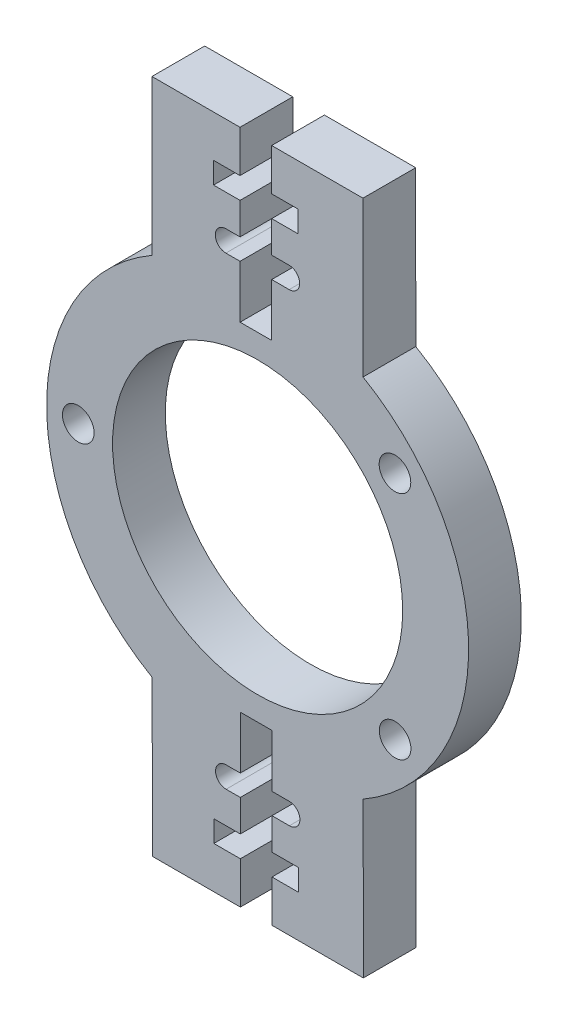
from build123d import *
from build123d.topology import SkipClean

# Parameters (mm, degrees)
SKETCH1_R           = 1.5
BOSS_EXTRUDE1_DEPTH = 5


with BuildPart() as part:
    # Sketch1 → Boss-Extrude1 (new body)
    with BuildSketch(Plane(origin=(0, 0, 0), x_dir=(-0.9999998655639977, -0.000518528674721734, 0), z_dir=(0, 0, 1))):
        with BuildLine():
            Line((20, 0), (18.5, 0))
            ThreePointArc((18.5, 0), (17, -1.5), (15.5, 0))
            Line((15.5, 0), (13.75, 0))
            ThreePointArc((13.75, 0), (0, -13.75), (-13.75, 0))
            Line((-13.75, 0), (-20, 0))
            ThreePointArc((-20, 0), (-17.320508076, -10), (-10, -17.320508076))
            Line((-10, -17.320508076), (-10, -32))
            Line((-10, -32), (-1.347069158, -32))
            Line((-1.347069158, -32), (-1.347069158, -28.031929013))
            Line((-1.347069158, -28.031929013), (-3.861161574, -28.031929013))
            Line((-3.861161574, -28.031929013), (-3.861161574, -26))
            Line((-3.861161574, -26), (-1.347069158, -26))
            Line((-1.347069158, -26), (-1.347069158, -23))
            Line((-1.347069158, -23), (-3, -23))
            ThreePointArc((-3, -23), (-4, -22), (-3, -21))
            Line((-3, -21), (-1.347069158, -21))
            Line((-1.347069158, -21), (-1.347069158, -16))
            Line((-1.347069158, -16), (1.652930842, -16))
            Line((1.652930842, -16), (1.652930842, -21))
            Line((1.652930842, -21), (3, -21))
            ThreePointArc((3, -21), (4, -22), (3, -23))
            Line((3, -23), (1.652930842, -23))
            Line((1.652930842, -23), (1.652930842, -26))
            Line((1.652930842, -26), (4.167023259, -26))
            Line((4.167023259, -26), (4.167023259, -28.031929013))
            Line((4.167023259, -28.031929013), (1.652930842, -28.031929013))
            Line((1.652930842, -28.031929013), (1.652930842, -32))
            Line((1.652930842, -32), (10, -32))
            Line((10, -32), (10, -17.320508076))
            ThreePointArc((10, -17.320508076), (17.320508076, -10), (20, 0))
        make_face()
        with Locations(Location((-13.022755533, -10.927389365, 0), (0, 0, 179.970290494))):
            Circle(SKETCH1_R, mode=Mode.SUBTRACT)
    boss_extrude1 = extrude(amount=BOSS_EXTRUDE1_DEPTH)

    # Mirror1: Boss-Extrude1 across plane
    with SkipClean():  # the faces are left unmerged after this step: merging them gives an invalid solid
        add(boss_extrude1.mirror(Plane(origin=(-1.06692597, -0.000553232, 5), x_dir=(0, 0, 1), z_dir=(-0.0005185286747217338, 0.9999998655639978, 0))))


solid = part.part
